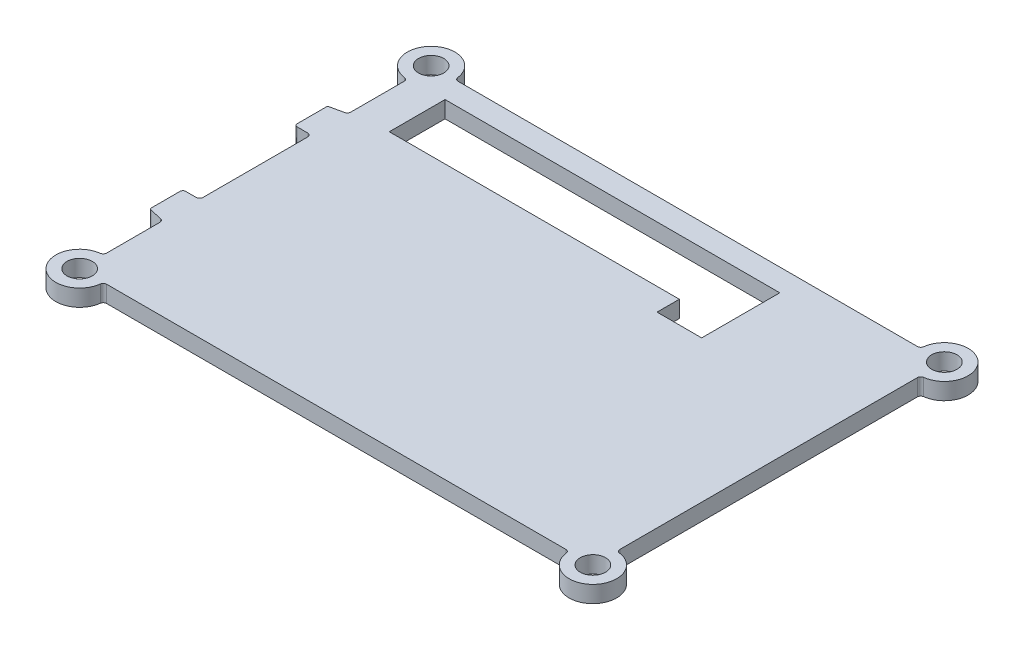
from build123d import *

# Parameters (mm, degrees)
SKETCH1_R           = 2.265
BOSS_EXTRUDE1_DEPTH = 3
CUT_EXTRUDE1_DEPTH  = 3
SKETCH3_W           = 6.5
SKETCH3_H           = 20
CUT_EXTRUDE2_DEPTH  = 3
BOSS_EXTRUDE2_DEPTH = 3
SKETCH5_W           = 6.5
SKETCH5_H           = 20
BOSS_EXTRUDE3_DEPTH = 3
FILLET1_R           = 0.6


with BuildPart() as part:
    # Sketch1 → Boss-Extrude1 (new body)
    with BuildSketch(Plane(origin=(0, 0, 0), x_dir=(1, 0, 0), z_dir=(0, 1, 0))):
        with BuildLine():
            Line((4.265, 0), (87.735, 0))
            ThreePointArc((87.735, 0), (95.015810422, 3.015810422), (92, -4.265))
            Line((92, -4.265), (92, -58.735))
            ThreePointArc((92, -58.735), (95.015810422, -66.015810422), (87.735, -63))
            Line((87.735, -63), (4.265, -63))
            ThreePointArc((4.265, -63), (-3.015810422, -66.015810422), (0, -58.735))
            Line((0, -58.735), (0, -4.265))
            ThreePointArc((0, -4.265), (-3.015810422, 3.015810422), (4.265, 0))
        make_face()
        with Locations(Location((0, 0, 0), (0, 0, 270))):
            Circle(SKETCH1_R, mode=Mode.SUBTRACT)
        with Locations(Location((92, 0, 0), (0, 0, 270))):
            Circle(SKETCH1_R, mode=Mode.SUBTRACT)
        with Locations(Location((92, -63, 0), (0, 0, 270))):
            Circle(SKETCH1_R, mode=Mode.SUBTRACT)
        with Locations(Location((0, -63, 0), (0, 0, 270))):
            Circle(SKETCH1_R, mode=Mode.SUBTRACT)
    extrude(amount=BOSS_EXTRUDE1_DEPTH)

    # Sketch2 → Cut-Extrude1 (cut)
    with BuildSketch(Plane(origin=(0, 3, 0), x_dir=(1, 0, 0), z_dir=(0, 1, 0))):
        Polygon((6.5, -4), (66.5, -4), (66.5, -14), (66.5, -18), (58.5, -18), (58.5, -14), (6.5, -14), align=None)
    extrude(amount=-CUT_EXTRUDE1_DEPTH, mode=Mode.SUBTRACT)

    # Sketch3 → Cut-Extrude2 (cut)
    with BuildSketch(Plane(origin=(0, 3, 0), x_dir=(1, 0, 0), z_dir=(0, 1, 0))):
        with Locations((3.25, -31.5)):
            Rectangle(SKETCH3_W, SKETCH3_H)
    extrude(amount=-CUT_EXTRUDE2_DEPTH, mode=Mode.SUBTRACT)

    # Sketch4 → Boss-Extrude2 (add)
    with BuildSketch(Plane(origin=(0, 3, 0), x_dir=(1, 0, 0), z_dir=(0, 1, 0))):
        with BuildLine():
            Line((-2.7, -15.5), (0, -14.9))
            Line((0, -14.9), (0, -21.5))
            Line((0, -21.5), (-2.5, -21.5))
            ThreePointArc((-2.5, -21.5), (-2.853553391, -21.353553391), (-3, -21))
            Line((-3, -21), (-3, -15.8))
            ThreePointArc((-3, -15.8), (-2.912132034, -15.587867966), (-2.7, -15.5))
        make_face()
        with BuildLine():
            Line((-3, -42), (-3, -47.2))
            ThreePointArc((-3, -47.2), (-2.912132034, -47.412132034), (-2.7, -47.5))
            Line((-2.7, -47.5), (0, -48.1))
            Line((0, -48.1), (0, -41.5))
            Line((0, -41.5), (-2.5, -41.5))
            ThreePointArc((-2.5, -41.5), (-2.853553391, -41.646446609), (-3, -42))
        make_face()
    extrude(amount=-BOSS_EXTRUDE2_DEPTH)

    # Sketch5 → Boss-Extrude3 (add)
    with BuildSketch(Plane(origin=(0, 3, 0), x_dir=(1, 0, 0), z_dir=(0, 1, 0))):
        with Locations((3.25, -31.5)):
            Rectangle(SKETCH5_W, SKETCH5_H)
    extrude(amount=-BOSS_EXTRUDE3_DEPTH)

    # Fillet1
    fillet1_edges = [part.edges().sort_by_distance(p)[0] for p in [
        (0, 1.5, 48.1),
        (0, 1.5, 41.5),
        (0, 1.5, 21.5),
        (92, 1.5, 4.265),
        (92, 1.5, 58.735),
        (87.735, 1.5, 63),
        (4.265, 1.5, 63),
        (0, 1.5, 58.735),
        (0, 1.5, 4.265),
        (4.265, 1.5, 0),
        (87.735, 1.5, 0),
        (0, 1.5, 14.9),
    ]]
    fillet(fillet1_edges, radius=FILLET1_R)


solid = part.part
